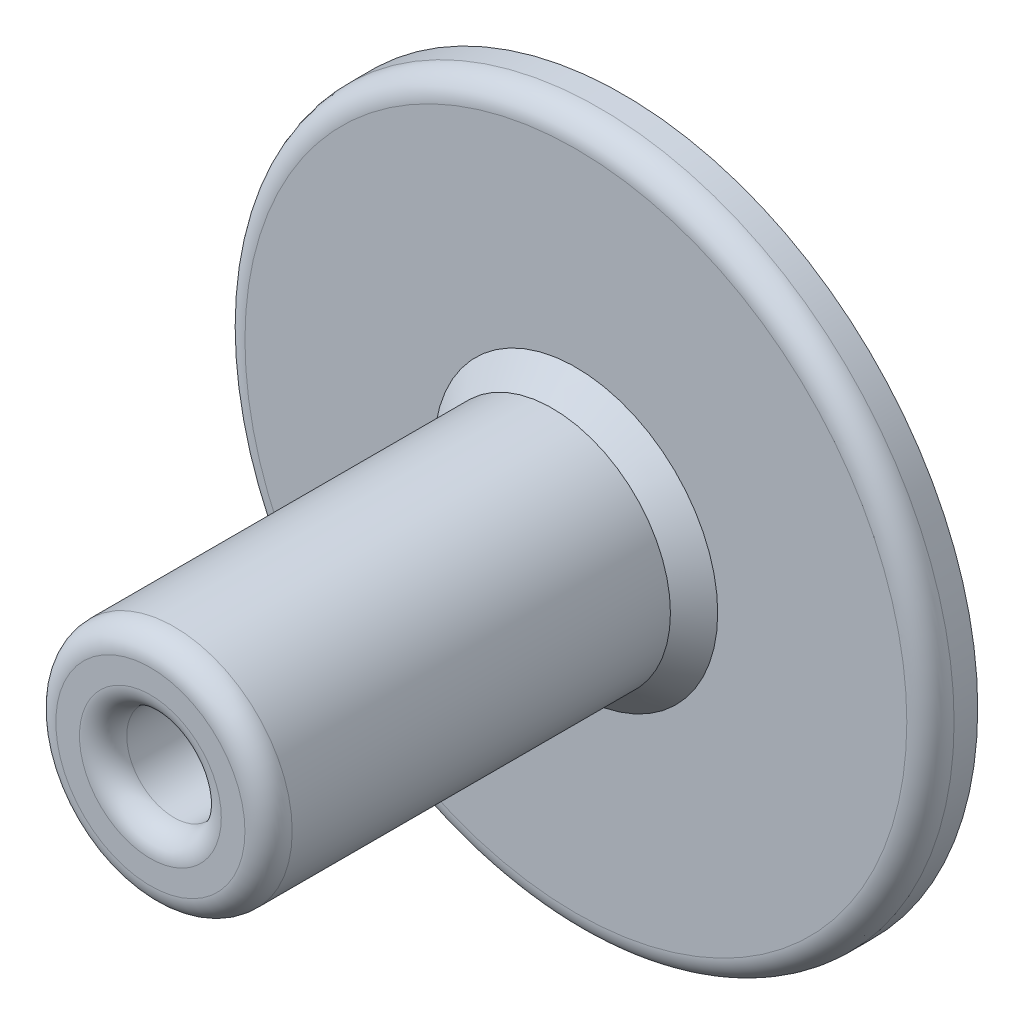
from build123d import *

# Parameters (mm, degrees)
SKETCH1_R           = 15
BOSS_EXTRUDE1_DEPTH = 2
SKETCH2_R           = 5
BOSS_EXTRUDE2_DEPTH = 18
SKETCH3_RX          = 2.7
SKETCH3_RY          = 2.2
CUT_EXTRUDE1_DEPTH  = 3
SKETCH4_R           = 2
CUT_EXTRUDE2_DEPTH  = 30
FILLET2_R           = 1
CHAMFER1_SIZE       = 1
FILLET3_R           = 1
FILLET4_R           = 1
FILLET6_R           = 1


with BuildPart() as part:
    # Sketch1 → Boss-Extrude1 (new body)
    with BuildSketch(Plane.XY):
        Circle(SKETCH1_R)
    extrude(amount=BOSS_EXTRUDE1_DEPTH)

    # Sketch2 → Boss-Extrude2 (add)
    with BuildSketch(Plane.XY.offset(2)):
        Circle(SKETCH2_R)
    extrude(amount=BOSS_EXTRUDE2_DEPTH)

    # Sketch3 → Cut-Extrude1 (cut)
    with BuildSketch(Plane(origin=(0, 0, 0), x_dir=(-1, 0, 0), z_dir=(0, 0, -1))):
        with Locations(Location((0, 0), (0, 0, 0))):
            Ellipse(SKETCH3_RX, SKETCH3_RY)
    extrude(amount=-CUT_EXTRUDE1_DEPTH, mode=Mode.SUBTRACT)

    # Sketch4 → Cut-Extrude2 (cut)
    with BuildSketch(Plane(origin=(0, 0, 0), x_dir=(-1, 0, 0), z_dir=(0, 0, -1))):
        Circle(SKETCH4_R)
    extrude(amount=-CUT_EXTRUDE2_DEPTH, mode=Mode.SUBTRACT)

    # Fillet2
    fillet2_edges = [part.edges().sort_by_distance(p)[0] for p in [
        (2.699999981, -0.000263168, 0),
    ]]
    fillet(fillet2_edges, radius=FILLET2_R)

    # Chamfer1
    chamfer1_edges = [part.edges().sort_by_distance(p)[0] for p in [
        (-5, 0, 2),
    ]]
    chamfer(chamfer1_edges, length=CHAMFER1_SIZE)

    # Fillet3
    fillet3_edges = [part.edges().sort_by_distance(p)[0] for p in [
        (-15, 0, 2),
    ]]
    fillet(fillet3_edges, radius=FILLET3_R)

    # Fillet4
    fillet4_edges = [part.edges().sort_by_distance(p)[0] for p in [
        (-5, 0, 20),
    ]]
    fillet(fillet4_edges, radius=FILLET4_R)

    # Fillet6
    fillet6_edges = [part.edges().sort_by_distance(p)[0] for p in [
        (2, 0, 20),
    ]]
    fillet(fillet6_edges, radius=FILLET6_R)


solid = part.part
